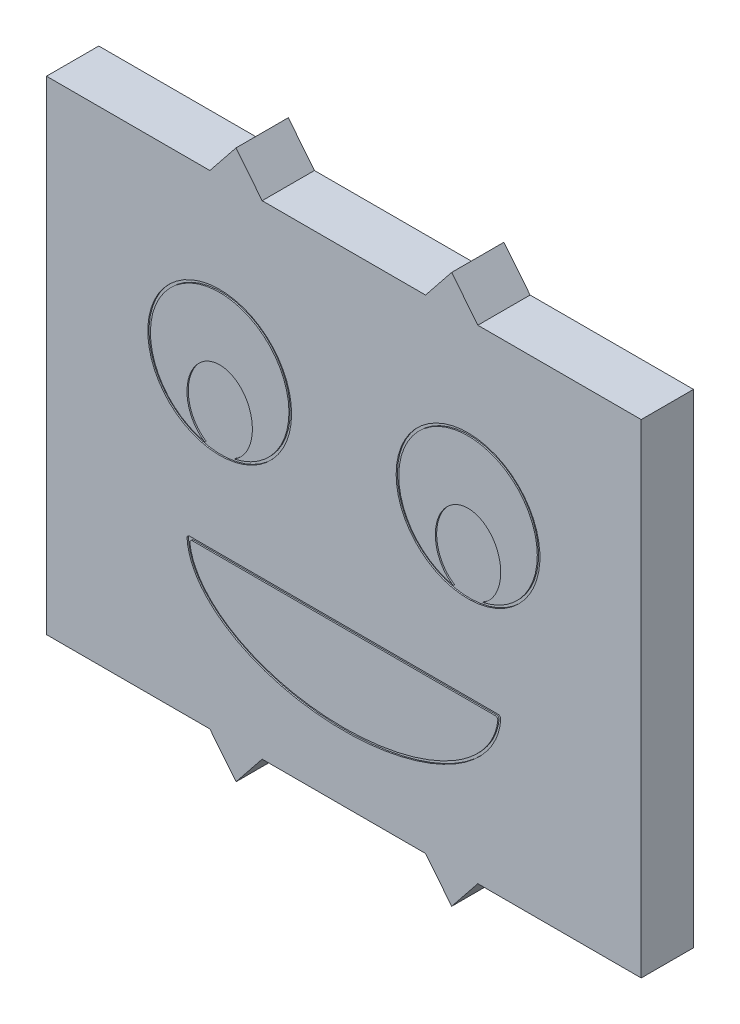
from build123d import *

# Parameters (mm, degrees)
BASIS_DEPTH         = 4
CUT_EXTRUDE10_DEPTH = 0.1
CUT_EXTRUDE14_DEPTH = 0.1
SKETCH10_9_R        = 5.5
SKETCH10_9_R_2      = 5.3
CUT_EXTRUDE16_DEPTH = 0.1
FILLET1_R           = 0.2


with BuildPart() as part:
    # Sketch1 → Basis (new body)
    with BuildSketch(Plane.XY):
        Polygon((0, 37), (0, 0), (12.5, 0), (14.5, -2.5), (16.5, 0), (29, 0), (31, -2.5), (33, 0), (45.5, 0), (45.5, 37), (33, 37), (31, 39.5), (29, 37), (16.5, 37), (14.5, 39.5), (12.5, 37), align=None)
    extrude(amount=BASIS_DEPTH)

    # Sketch10 → Cut-Extrude10 (cut)
    with BuildSketch(Plane.XY.offset(4)):
        with BuildLine():
            Line((34.75, 12), (10.75, 12))
            add(Edge.make_bspline(
                [(10.75, 12), (10.75, 5), (22.75, 5), (34.75, 5), (34.75, 12)],
                knots=[0, 0, 0, 1.570796327, 1.570796327, 3.141592654, 3.141592654, 3.141592654], degree=2, weights=[1, 0.707106781, 1, 0.707106781, 1]))
        make_face()
        with BuildLine():
            add(Edge.make_bspline(
                [(34.544848739, 11.8), (34.522497462, 11.366189062), (34.337619942, 10.522792028), (33.405825268, 8.867470761), (31.220098023, 7.030241966), (27.326621533, 5.547133455), (22.75, 5.026433272), (18.173378467, 5.547133455), (14.279901977, 7.030241966), (12.094174732, 8.867470761), (11.162380058, 10.522792028), (10.977502538, 11.366189062), (10.955151261, 11.8)],
                knots=[3.171638741, 3.171638741, 3.171638741, 3.171638741, 3.364232521, 3.556826301, 3.942013861, 4.32720142, 4.71238898, 5.09757654, 5.4827641, 5.86795166, 6.06054544, 6.25313922, 6.25313922, 6.25313922, 6.25313922], degree=3))
            Line((10.955151261, 11.8), (34.544848739, 11.8))
        make_face(mode=Mode.SUBTRACT)
    extrude(amount=-CUT_EXTRUDE10_DEPTH, mode=Mode.SUBTRACT)

    # Sketch10<6> → Cut-Extrude14 (cut)
    with BuildSketch(Plane.XY.offset(4)):
        with BuildLine():
            ThreePointArc((12.125360528, 18.820696373), (13.25, 18.7), (14.374639472, 18.820696373))
            add(Edge.make_bspline(
                [(14.374639472, 18.820696373), (17.140586708, 20.492548158), (15.195293354, 23.38435682), (13.25, 26.276165482), (11.304706646, 23.38435682), (9.359413292, 20.492548158), (12.125360528, 18.820696373)],
                knots=[0.46660386, 0.46660386, 0.46660386, 2.249929722, 2.249929722, 4.033255585, 4.033255585, 5.816581447, 5.816581447, 5.816581447], degree=2, weights=[1, 0.62811894, 1, 0.62811894, 1, 0.62811894, 1]))
        make_face()
    cut_extrude14 = extrude(amount=-CUT_EXTRUDE14_DEPTH, mode=Mode.SUBTRACT)

    # Sketch10<9> → Cut-Extrude16 (cut)
    with BuildSketch(Plane.XY.offset(4)):
        with Locations((13.25, 24)):
            Circle(SKETCH10_9_R)
        with Locations((13.25, 24)):
            Circle(SKETCH10_9_R_2, mode=Mode.SUBTRACT)
    cut_extrude16 = extrude(amount=-CUT_EXTRUDE16_DEPTH, mode=Mode.SUBTRACT)

    # Mirror1: Cut-Extrude14, Cut-Extrude16 across plane
    add(cut_extrude14.mirror(Plane.ZY.offset(-22.75)), mode=Mode.SUBTRACT)
    add(cut_extrude16.mirror(Plane.ZY.offset(-22.75)), mode=Mode.SUBTRACT)

    # Fillet1
    fillet1_edges = [part.edges().sort_by_distance(p)[0] for p in [
        (34.544848739, 11.8, 3.95),
        (34.75, 12, 3.95),
        (10.955151261, 11.8, 3.95),
        (10.75, 12, 3.95),
    ]]
    fillet(fillet1_edges, radius=FILLET1_R)


solid = part.part
